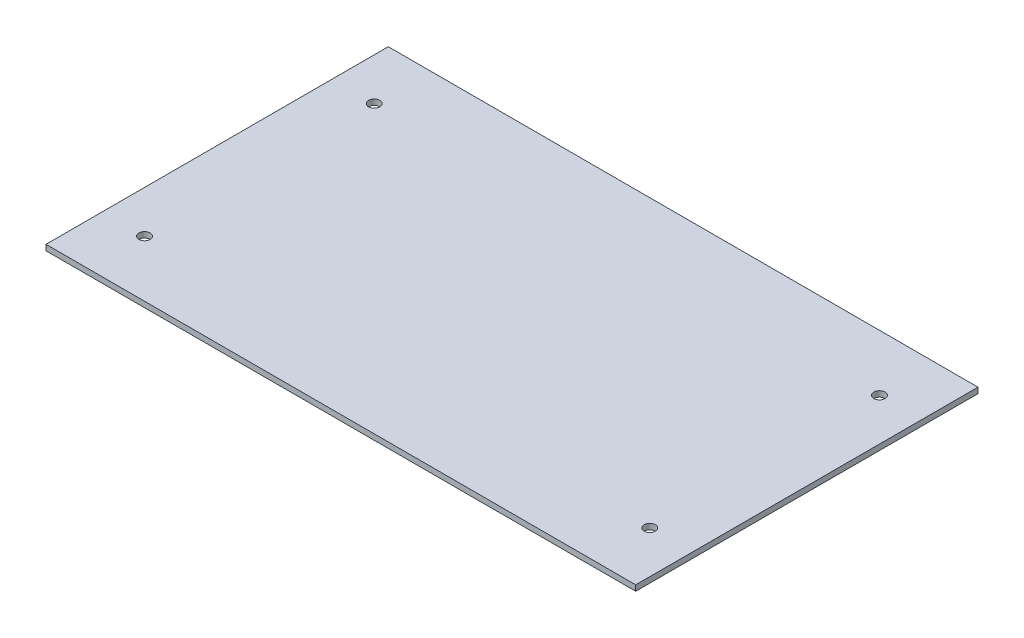
from build123d import *

# Parameters (mm, degrees)
SKETCH1_W               = 209.5
SKETCH1_H               = 121.6
BOSS_EXTRUDE1_DEPTH     = 2
CUT_EXTRUDE1_DEPTH      = 160.000086316
CUT_EXTRUDE1_DEPTH_BACK = 160.000086316
SKETCH2_R               = 2


with BuildPart() as part:
    # Sketch1 → Boss-Extrude1 (new body)
    with BuildSketch(Plane(origin=(0, 0, 0), x_dir=(1, 0, 0), z_dir=(0, 1, 0))):
        with Locations((27.162313362, -27.947783251)):
            Rectangle(SKETCH1_W, SKETCH1_H)
    extrude(amount=BOSS_EXTRUDE1_DEPTH)

    # Sketch2 → Cut-Extrude1 (cut, two sides: drawn at the far end of the back side and taken through both)
    with BuildSketch(Plane(origin=(0, 2, 0), x_dir=(1, 0, 0), z_dir=(0, 1, 0)).offset(-CUT_EXTRUDE1_DEPTH_BACK)):
        with Locations(Location((-62.587686638, 12.852216749, 0), (0, 0, 270))):
            Circle(SKETCH2_R)
        with Locations(Location((116.912313362, 12.852216749, 0), (0, 0, 270))):
            Circle(SKETCH2_R)
        with Locations(Location((-62.587686638, -68.747783251, 0), (0, 0, 270))):
            Circle(SKETCH2_R)
        with Locations(Location((116.912313362, -68.747783251, 0), (0, 0, 270))):
            Circle(SKETCH2_R)
    extrude(amount=CUT_EXTRUDE1_DEPTH + CUT_EXTRUDE1_DEPTH_BACK, mode=Mode.SUBTRACT)


solid = part.part
